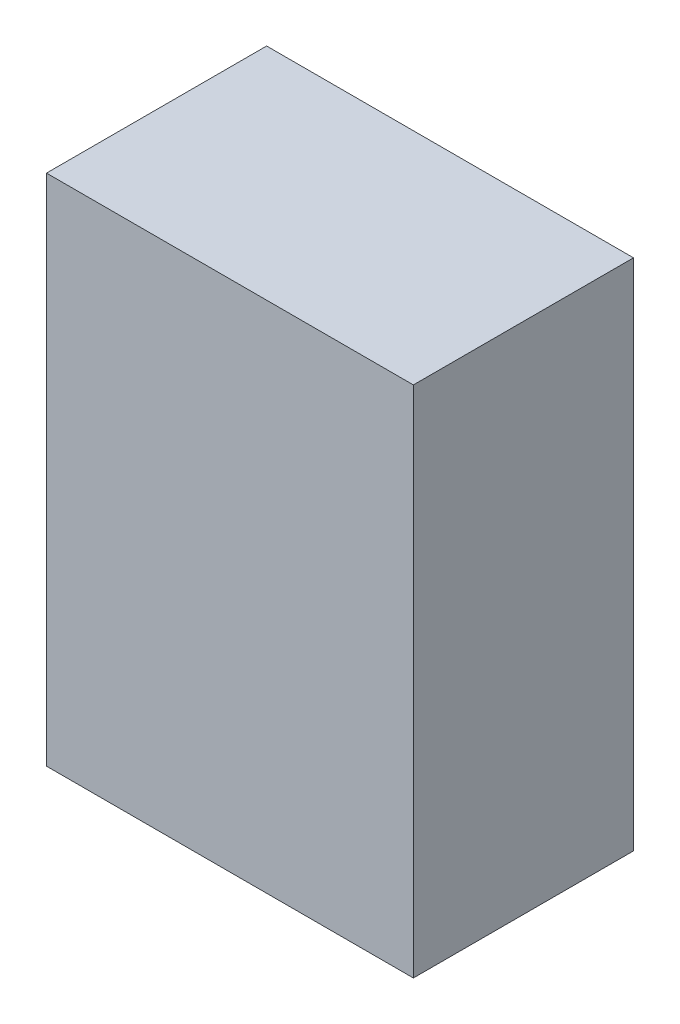
from build123d import *

# Parameters (mm, degrees)
SKETCH1_W           = 70
SKETCH1_H           = 50
BOSS_EXTRUDE1_DEPTH = 30


with BuildPart() as part:
    # Sketch1 → Boss-Extrude1 (new body)
    with BuildSketch(Plane(origin=(0, 0, 0), x_dir=(0, 1, 0), z_dir=(0, 0, 1))):
        with Locations((35, 25)):
            Rectangle(SKETCH1_W, SKETCH1_H)
    extrude(amount=BOSS_EXTRUDE1_DEPTH)


solid = part.part
